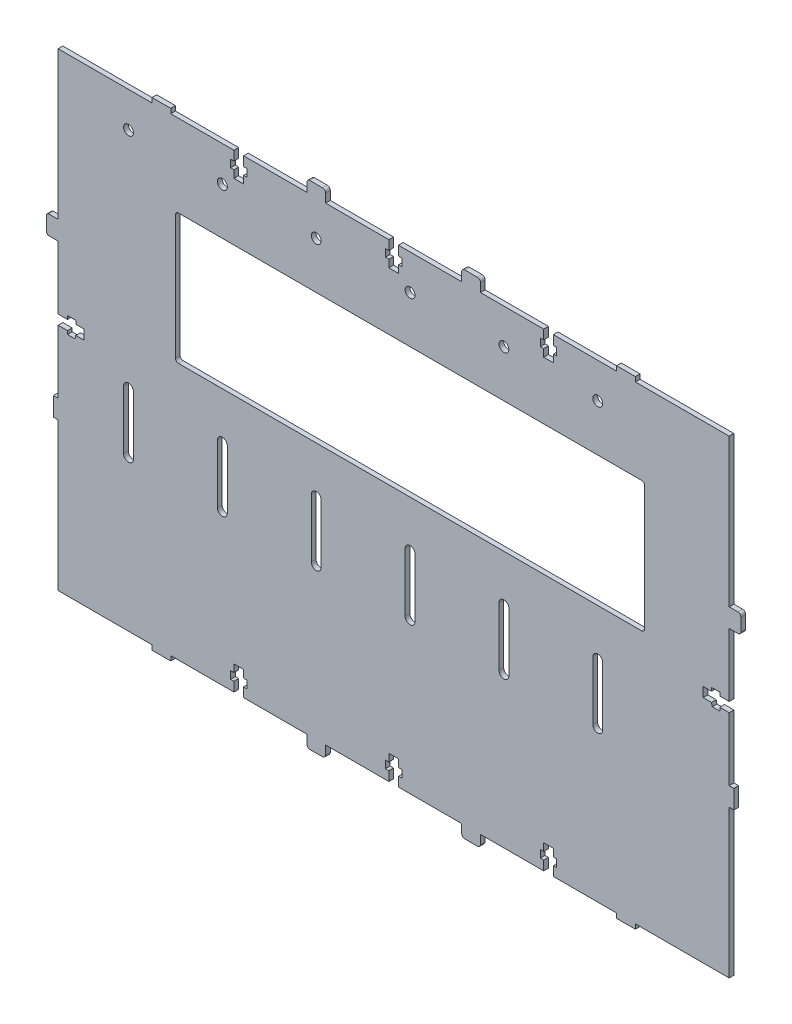
from build123d import *

# Parameters (mm, degrees)
SKETCH_1_R          = 2.1
SKETCH_1_W          = 200
SKETCH_1_H          = 55.5
EXTRUDE_1_DEPTH     = 2
FILLET_1_R          = 1
FILLET_2_R          = 1.3
SKETCH_4_W          = 16.091181195
SKETCH_4_H          = 8.262872831
SKETCH_4_W_2        = 19.931884343
SKETCH_4_W_3        = 14.487561678
SKETCH_4_H_2        = 5.890006991
SKETCH_4_W_4        = 16.715065691
SKETCH_4_H_3        = 8.177759915
SKETCH_4_W_5        = 10.105714663
SKETCH_4_H_4        = 26.066396506
SKETCH_4_W_6        = 5.661455371
SKETCH_4_H_5        = 27.456761526
CUT_EXTRUDE_1_DEPTH = 2


with BuildPart() as part:
    # 草图1 → 凸台-拉伸1 (new body)
    with BuildSketch(Plane.XY):
        Polygon((0, 0), (0, -4), (-1.45, -4), (-1.45, -7.2), (0, -7.2), (0, -10.4), (4.1, -10.4), (4.1, -7.2), (5.55, -7.2), (5.55, -4), (4.1, -4), (4.1, 0), (31.05, 0), (31.05, 5), (39.05, 5), (39.05, 0), (66, 0), (66, -4), (64.55, -4), (64.55, -7.2), (66, -7.2), (66, -10.4), (70.1, -10.4), (70.1, -7.2), (71.55, -7.2), (71.55, -4), (70.1, -4), (70.1, 0), (97.05, 0), (97.05, 5), (105.05, 5), (105.05, 0), (132, 0), (145.05, 0), (145.05, -63), (150.05, -63), (150.05, -71), (145.05, -71), (145.05, -97.95), (141.05, -97.95), (141.05, -96.490258022), (137.515203406, -96.490258022), (137.515203406, -97.95), (133.980406811, -97.95), (133.980406811, -102.05), (137.515203406, -102.05), (137.850237274, -103.470774067), (141.05, -103.509741978), (141.05, -102.05), (145.05, -102.05), (145.05, -129), (150.05, -129), (150.05, -137), (145.05, -137), (145.05, -200), (132, -200), (105.05, -200), (105.05, -205), (97.05, -205), (97.05, -200), (70.1, -200), (70.1, -196), (71.55, -196), (71.55, -192.8), (70.1, -192.8), (70.1, -189.6), (66, -189.6), (66, -192.8), (64.55, -192.8), (64.55, -196), (66, -196), (66, -200), (39.05, -200), (39.05, -205), (31.05, -205), (31.05, -200), (4.1, -200), (4.1, -196), (5.55, -196), (5.55, -192.8), (4.1, -192.8), (4.1, -189.6), (0, -189.6), (0, -192.8), (-1.45, -192.8), (-1.45, -196), (0, -196), (0, -200), (-26.95, -200), (-26.95, -205), (-34.95, -205), (-34.95, -200), (-61.9, -200), (-61.9, -196), (-60.45, -196), (-60.45, -192.8), (-61.9, -192.8), (-61.9, -189.6), (-66, -189.6), (-66, -192.8), (-67.45, -192.8), (-67.45, -196), (-66, -196), (-66, -200), (-92.95, -200), (-92.95, -205), (-100.95, -205), (-100.95, -200), (-127.9, -200), (-140.95, -200), (-140.95, -137), (-145.95, -137), (-145.95, -129), (-140.95, -129), (-140.95, -102.05), (-136.95, -102.05), (-136.95, -103.509741978), (-133.750237274, -103.470774067), (-133.415203406, -102.05), (-129.880406811, -102.05), (-129.880406811, -97.95), (-133.415203406, -97.95), (-133.415203406, -96.490258022), (-136.95, -96.490258022), (-136.95, -97.95), (-140.95, -97.95), (-140.95, -71), (-145.95, -71), (-145.95, -63), (-140.95, -63), (-140.95, 0), (-127.9, 0), (-100.95, 0), (-100.95, 5), (-92.95, 5), (-92.95, 0), (-66, 0), (-66, -4), (-67.45, -4), (-67.45, -7.2), (-66, -7.2), (-66, -10.4), (-61.9, -10.4), (-61.9, -7.2), (-60.45, -7.2), (-60.45, -4), (-61.9, -4), (-61.9, 0), (-34.95, 0), (-34.95, 5), (-26.95, 5), (-26.95, 0), align=None)
        with Locations((-110.95, -15)):
            Circle(SKETCH_1_R, mode=Mode.SUBTRACT)
        with Locations((-70.95, -15)):
            Circle(SKETCH_1_R, mode=Mode.SUBTRACT)
        with Locations((-30.95, -15)):
            Circle(SKETCH_1_R, mode=Mode.SUBTRACT)
        with Locations((9.05, -15)):
            Circle(SKETCH_1_R, mode=Mode.SUBTRACT)
        with Locations((49.05, -15)):
            Circle(SKETCH_1_R, mode=Mode.SUBTRACT)
        with Locations((89.05, -15)):
            Circle(SKETCH_1_R, mode=Mode.SUBTRACT)
        with Locations((9.05, -62.75)):
            Rectangle(SKETCH_1_W, SKETCH_1_H, mode=Mode.SUBTRACT)
        with BuildLine():
            Line((-113.05, -135.5), (-113.05, -110.5))
            ThreePointArc((-113.05, -110.5), (-110.95, -108.4), (-108.85, -110.5))
            Line((-108.85, -110.5), (-108.85, -135.5))
            ThreePointArc((-108.85, -135.5), (-110.95, -137.6), (-113.05, -135.5))
        make_face(mode=Mode.SUBTRACT)
        with BuildLine():
            Line((-73.05, -135.5), (-73.05, -110.5))
            ThreePointArc((-73.05, -110.5), (-70.95, -108.4), (-68.85, -110.5))
            Line((-68.85, -110.5), (-68.85, -135.5))
            ThreePointArc((-68.85, -135.5), (-70.95, -137.6), (-73.05, -135.5))
        make_face(mode=Mode.SUBTRACT)
        with BuildLine():
            Line((-33.05, -135.5), (-33.05, -110.5))
            ThreePointArc((-33.05, -110.5), (-30.95, -108.4), (-28.85, -110.5))
            Line((-28.85, -110.5), (-28.85, -135.5))
            ThreePointArc((-28.85, -135.5), (-30.95, -137.6), (-33.05, -135.5))
        make_face(mode=Mode.SUBTRACT)
        with BuildLine():
            Line((6.95, -135.5), (6.95, -110.5))
            ThreePointArc((6.95, -110.5), (9.05, -108.4), (11.15, -110.5))
            Line((11.15, -110.5), (11.15, -135.5))
            ThreePointArc((11.15, -135.5), (9.05, -137.6), (6.95, -135.5))
        make_face(mode=Mode.SUBTRACT)
        with BuildLine():
            Line((46.95, -135.5), (46.95, -110.5))
            ThreePointArc((46.95, -110.5), (49.05, -108.4), (51.15, -110.5))
            Line((51.15, -110.5), (51.15, -135.5))
            ThreePointArc((51.15, -135.5), (49.05, -137.6), (46.95, -135.5))
        make_face(mode=Mode.SUBTRACT)
        with BuildLine():
            Line((86.95, -135.5), (86.95, -110.5))
            ThreePointArc((86.95, -110.5), (89.05, -108.4), (91.15, -110.5))
            Line((91.15, -110.5), (91.15, -135.5))
            ThreePointArc((91.15, -135.5), (89.05, -137.6), (86.95, -135.5))
        make_face(mode=Mode.SUBTRACT)
    extrude(amount=EXTRUDE_1_DEPTH)

    # 圆角1
    fillet_1_edges = [part.edges().sort_by_distance(p)[0] for p in [
        (-145.95, -137, 1),
        (-145.95, -129, 1),
        (-145.95, -71, 1),
        (-145.95, -63, 1),
    ]]
    fillet(fillet_1_edges, radius=FILLET_1_R)

    # 圆角2
    fillet_2_edges = [part.edges().sort_by_distance(p)[0] for p in [
        (31.05, 5, 1),
        (39.05, 5, 1),
        (97.05, 5, 1),
        (105.05, 5, 1),
        (150.05, -63, 1),
        (150.05, -71, 1),
        (150.05, -129, 1),
        (150.05, -137, 1),
        (105.05, -205, 1),
        (97.05, -205, 1),
        (39.05, -205, 1),
        (31.05, -205, 1),
        (-26.95, -205, 1),
        (-34.95, -205, 1),
        (-92.95, -205, 1),
        (-100.95, -205, 1),
        (-100.95, 5, 1),
        (-92.95, 5, 1),
        (-34.95, 5, 1),
        (-26.95, 5, 1),
        (109.05, -35, 1),
        (-90.95, -35, 1),
        (-90.95, -90.5, 1),
        (109.05, -90.5, 1),
    ]]
    fillet(fillet_2_edges, radius=FILLET_2_R)

    # 草图4 → 切除-拉伸1 (cut)
    with BuildSketch(Plane.XY.offset(2)):
        with Locations((-95.339833075, 6.131436416)):
            Rectangle(SKETCH_4_W, SKETCH_4_H)
        with Locations((100.859067665, 6.131436416)):
            Rectangle(SKETCH_4_W_2, SKETCH_4_H)
        with Locations((-97.37103045, -204.945003496)):
            Rectangle(SKETCH_4_W_3, SKETCH_4_H_2)
        with Locations((102.467476991, -206.088879958)):
            Rectangle(SKETCH_4_W_4, SKETCH_4_H_3)
        with Locations((-148.002857332, -124.681219337)):
            Rectangle(SKETCH_4_W_5, SKETCH_4_H_4)
        with Locations((149.880727686, -127.664492951)):
            Rectangle(SKETCH_4_W_6, SKETCH_4_H_5)
    extrude(amount=-CUT_EXTRUDE_1_DEPTH, mode=Mode.SUBTRACT)


solid = part.part
